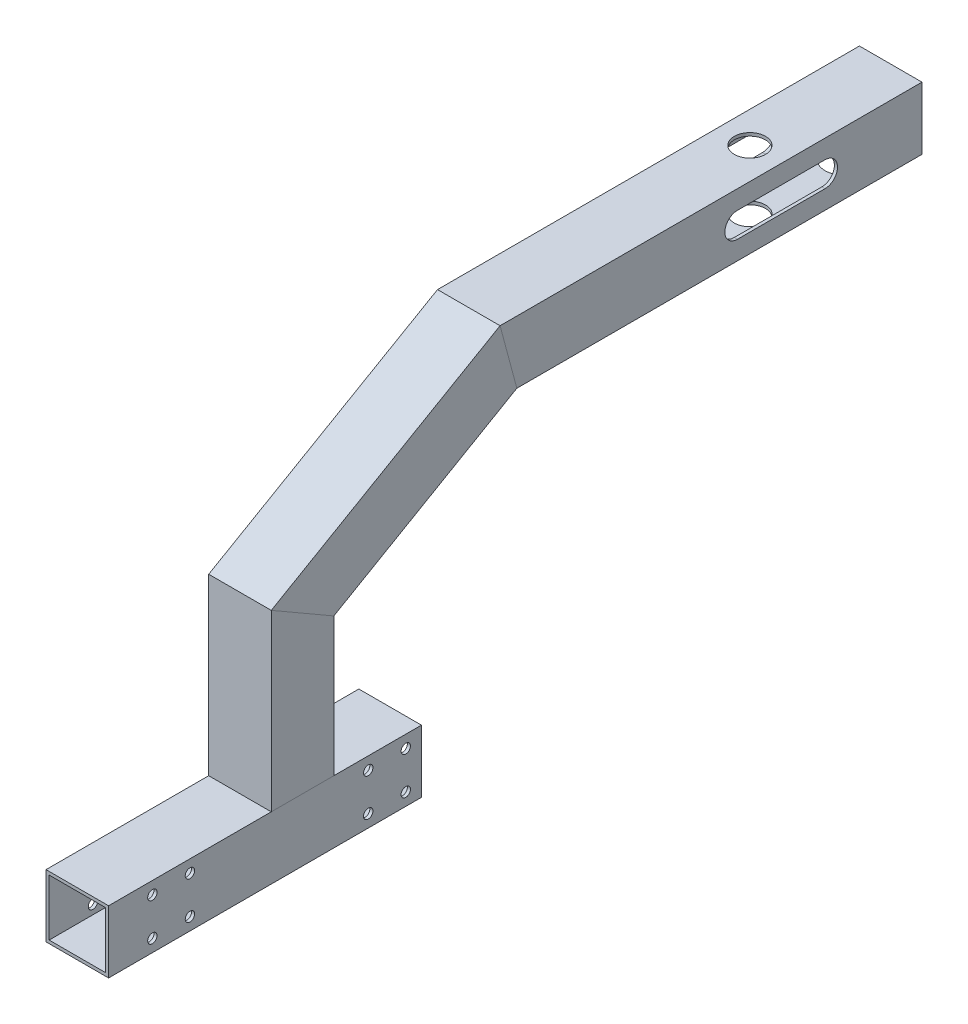
from build123d import *

# Parameters (mm, degrees)
SKETCH_11_W                = 20
SKETCH_11_H                = 20
SKETCH_11_W_2              = 18
SKETCH_11_H_2              = 18
F_20X20X1_14_DEPTH         = 100
SKETCH_11_ON_SEGMENT_2_W   = 20
SKETCH_11_ON_SEGMENT_2_H   = 20
SKETCH_11_ON_SEGMENT_2_W_2 = 18
SKETCH_11_ON_SEGMENT_2_H_2 = 18
F_20X20X1_14_2_DEPTH       = 70.164965809
SKETCH_11_ON_SEGMENT_3_W   = 20
SKETCH_11_ON_SEGMENT_3_H   = 20
SKETCH_11_ON_SEGMENT_3_W_2 = 18
SKETCH_11_ON_SEGMENT_3_H_2 = 18
F_20X20X1_14_3_DEPTH       = 89.954339629
SKETCH_11_ON_SEGMENT_4_W   = 20
SKETCH_11_ON_SEGMENT_4_H   = 20
SKETCH_11_ON_SEGMENT_4_W_2 = 18
SKETCH_11_ON_SEGMENT_4_H_2 = 18
F_20X20X1_14_4_DEPTH       = 136.971443132
SKETCH_12_R                = 1.5
CUT_EXTRUDE_1_DEPTH        = 283.248117797
SKETCH_13_R                = 5
CUT_EXTRUDE_2_DEPTH        = 279.035968896
CUT_EXTRUDE_3_DEPTH        = 283.248117797
SKETCH_15_R                = 6
CUT_EXTRUDE_4_DEPTH        = 1
SKETCH_16_R                = 1.5
CUT_EXTRUDE_5_DEPTH        = 1


with BuildPart() as part:
    # 草图11 → 铝管 20X20X1(14) (new body)
    with BuildSketch(Plane.YX):
        Rectangle(SKETCH_11_W, SKETCH_11_H)
        Rectangle(SKETCH_11_W_2, SKETCH_11_H_2, mode=Mode.SUBTRACT)
    extrude(amount=F_20X20X1_14_DEPTH)

    # 草图12 → 切除-拉伸1 (cut, through all)
    with BuildSketch(Plane(origin=(10, 0, 0), x_dir=(0, 0, -1), z_dir=(1, 0, 0))):
        with Locations((14, 6)):
            Circle(SKETCH_12_R)
        with Locations((14, -6)):
            Circle(SKETCH_12_R)
        with Locations((26, 6)):
            Circle(SKETCH_12_R)
        with Locations((26, -6)):
            Circle(SKETCH_12_R)
        with Locations((83, 6)):
            Circle(SKETCH_12_R)
        with Locations((83, -6)):
            Circle(SKETCH_12_R)
        with Locations((95, 6)):
            Circle(SKETCH_12_R)
        with Locations((95, -6)):
            Circle(SKETCH_12_R)
    extrude(amount=-CUT_EXTRUDE_1_DEPTH, mode=Mode.SUBTRACT)


with BuildPart() as body_2:
    # 草图11 on segment 2 (carried to segment 2) → 20X20X1_14 2 (new body)
    with BuildSketch(Plane(origin=(0, -1, -62), x_dir=(0, 0, 1), z_dir=(0, 1, 0))):
        Rectangle(SKETCH_11_ON_SEGMENT_2_W, SKETCH_11_ON_SEGMENT_2_H)
        Rectangle(SKETCH_11_ON_SEGMENT_2_W_2, SKETCH_11_ON_SEGMENT_2_H_2, mode=Mode.SUBTRACT)
    extrude(amount=F_20X20X1_14_2_DEPTH)

    # 20X20X1_14 2 mitre 1
    split(bisect_by=Plane(origin=(0, 60, -62), x_dir=(1, 0, 0), z_dir=(0, -0.866025404, 0.5)), keep=Keep.TOP)

    # 20X20X1_14 2 mitre 2
    split(bisect_by=Plane(origin=(0, 10, -62), x_dir=(-1, 0, 0), z_dir=(0, 1, 0)), keep=Keep.TOP)


with BuildPart() as body_3:
    # 草图11 on segment 3 (carried to segment 3) → 20X20X1_14 3 (new body)
    with BuildSketch(Plane(origin=(0, 55.417517095, -54.062906784), x_dir=(0, 0.866025404, 0.5), z_dir=(0, 0.5, -0.866025404))):
        Rectangle(SKETCH_11_ON_SEGMENT_3_W, SKETCH_11_ON_SEGMENT_3_H)
        Rectangle(SKETCH_11_ON_SEGMENT_3_W_2, SKETCH_11_ON_SEGMENT_3_H_2, mode=Mode.SUBTRACT)
    extrude(amount=F_20X20X1_14_3_DEPTH)

    # 20X20X1_14 3 mitre 1
    split(bisect_by=Plane(origin=(0, 60, -62), x_dir=(-1, 0, 0), z_dir=(0, 0.866025404, -0.5)), keep=Keep.TOP)

    # 20X20X1_14 3 mitre 2
    split(bisect_by=Plane(origin=(0, 98, -127.817930688), x_dir=(0, -0.965925826, -0.258819045), z_dir=(0, -0.258819045, 0.965925826)), keep=Keep.TOP)


with BuildPart() as body_4:
    # 草图11 on segment 4 (carried to segment 4) → 20X20X1_14 4 (new body)
    with BuildSketch(Plane(origin=(0, 98, -123.028556868), x_dir=(0, 1, 0), z_dir=(0, 0, -1))):
        Rectangle(SKETCH_11_ON_SEGMENT_4_W, SKETCH_11_ON_SEGMENT_4_H)
        Rectangle(SKETCH_11_ON_SEGMENT_4_W_2, SKETCH_11_ON_SEGMENT_4_H_2, mode=Mode.SUBTRACT)
    extrude(amount=F_20X20X1_14_4_DEPTH)

    # 20X20X1_14 4 mitre 1
    split(bisect_by=Plane(origin=(0, 98, -127.817930688), x_dir=(0, 0.965925826, 0.258819045), z_dir=(0, 0.258819045, -0.965925826)), keep=Keep.TOP)

    # 草图13 → 切除-拉伸2 (cut, through all)
    with BuildSketch(Plane.XZ.offset(-88)):
        with Locations(Location((0, -215, 0), (0, 0, 270))):
            Circle(SKETCH_13_R)
    extrude(amount=-CUT_EXTRUDE_2_DEPTH, mode=Mode.SUBTRACT)

    # 草图14 → 切除-拉伸3 (cut, through all)
    with BuildSketch(Plane(origin=(10, 0, 0), x_dir=(0, 0, -1), z_dir=(1, 0, 0))):
        with BuildLine():
            Line((201, 102), (229, 102))
            ThreePointArc((229, 102), (233, 98), (229, 94))
            Line((229, 94), (201, 94))
            ThreePointArc((201, 94), (197, 98), (201, 102))
        make_face()
    extrude(amount=-CUT_EXTRUDE_3_DEPTH, mode=Mode.SUBTRACT)

    # 草图15 → 切除-拉伸4 (cut)
    with BuildSketch(Plane.XZ.offset(-88)):
        with Locations(Location((0, -245, 0), (0, 0, 270))):
            Circle(SKETCH_15_R)
    extrude(amount=-CUT_EXTRUDE_4_DEPTH, mode=Mode.SUBTRACT)

    # 草图16 → 切除-拉伸5 (cut)
    with BuildSketch(Plane.XZ.offset(-88)):
        with Locations(Location((6, -254, 0), (0, 0, 270))):
            Circle(SKETCH_16_R)
    extrude(amount=-CUT_EXTRUDE_5_DEPTH, mode=Mode.SUBTRACT)


solid = Compound([part.part, body_2.part, body_3.part, body_4.part])
